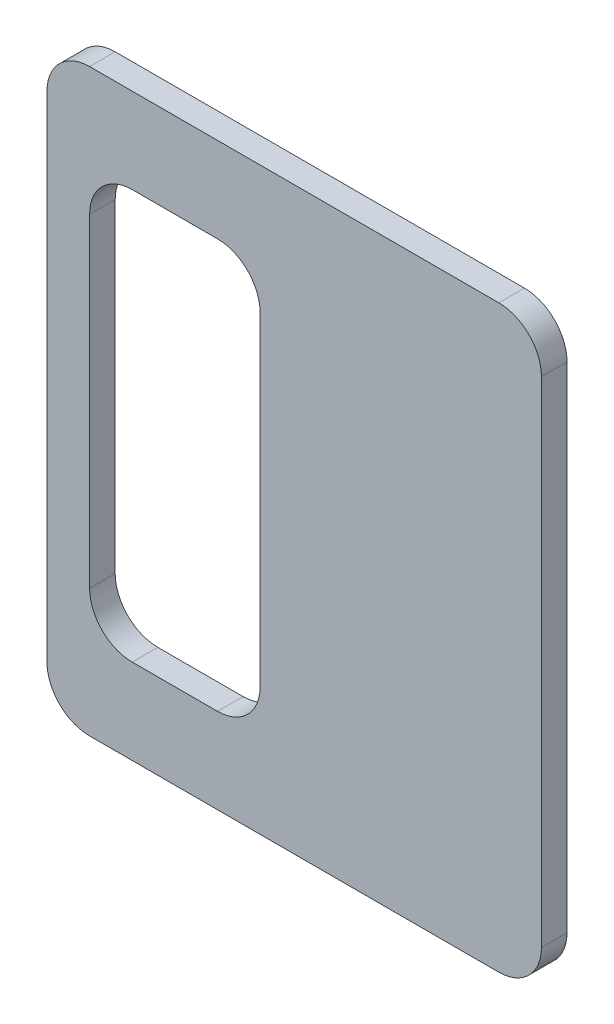
from build123d import *

# Parameters (mm, degrees)
SKETCH1_W           = 58
SKETCH1_H           = 68
SKETCH1_W_2         = 20
SKETCH1_H_2         = 48
BOSS_EXTRUDE1_DEPTH = 3
FILLET2_R           = 5
FILLET3_R           = 5


with BuildPart() as part:
    # Sketch1 → Boss-Extrude1 (new body)
    with BuildSketch(Plane.XY):
        with Locations((29, 34)):
            Rectangle(SKETCH1_W, SKETCH1_H)
        with Locations((15, 34)):
            Rectangle(SKETCH1_W_2, SKETCH1_H_2, mode=Mode.SUBTRACT)
    extrude(amount=BOSS_EXTRUDE1_DEPTH)

    # Fillet2
    fillet2_edges = [part.edges().sort_by_distance(p)[0] for p in [
        (0, 68, 1.5),
        (58, 68, 1.5),
        (58, 0, 1.5),
        (0, 0, 1.5),
    ]]
    fillet(fillet2_edges, radius=FILLET2_R)

    # Fillet3
    fillet3_edges = [part.edges().sort_by_distance(p)[0] for p in [
        (5, 58, 1.5),
        (5, 10, 1.5),
        (25, 10, 1.5),
        (25, 58, 1.5),
    ]]
    fillet(fillet3_edges, radius=FILLET3_R)


solid = part.part
